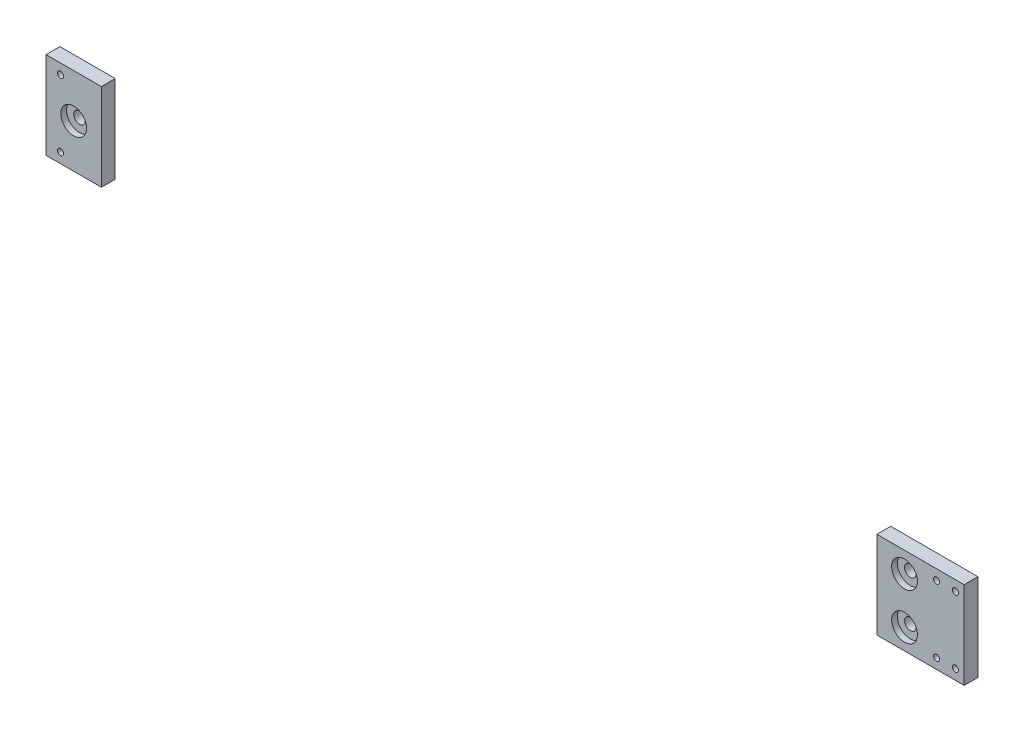
from build123d import *

# Parameters (mm, degrees)
SKETCH2_W                                 = 66.588019288
SKETCH2_H                                 = 60
MAIN_EXTRUSION_DEPTH                      = 5.55752
SKETCH2_W_2                               = 38.1
SKETCH2_R                                 = 3.96875
MAIN_EXTRUSION_2_DEPTH                    = 5.55752
SKETCH2_3_W                               = 66.588019288
SKETCH2_3_H                               = 60
SKETCH2_3_W_2                             = 38.1
SKETCH2_3_R                               = 8.89
COUNTERBORE_EXTRUSION_DEPTH               = 9.525
SKETCH3_R                                 = 2.1
M5_THREADED_HOLSE_FOR_FRONT_BRACKET_DEPTH = 9.525
SKETCH5_R                                 = 2.1
M5_THREADED_HOLES_FOR_BRACKET_DEPTH       = 9.525
CENTRE_BORE_DEPTH                         = 345.266911292
SKETCH6_3_R                               = 8.89
SKETCH6_3_R_2                             = 3.96875
COUNTERBORE_DEPTH                         = 3.96748
SKETCH7_W                                 = 6.55
SKETCH7_H                                 = 60
STUPID_CUT_DEPTH                          = 345.266911292


with BuildPart() as part:
    # Sketch2 → Main Extrusion (new body)
    with BuildSketch(Plane(origin=(-0.000152858, 6.01e-07, 0.001029772), x_dir=(1, 0, 0), z_dir=(0, 0, 1))):
        with Locations((309.531143156, -6.01e-07)):
            Rectangle(SKETCH2_W, SKETCH2_H)
    extrude(amount=MAIN_EXTRUSION_DEPTH)



with BuildPart() as body_2:
    # Sketch2 → Main Extrusion 2 (new body)
    with BuildSketch(Plane(origin=(-0.000152858, 6.01e-07, 0.001029772), x_dir=(1, 0, 0), z_dir=(0, 0, 1))):
        with Locations((-276.224847142, -6.01e-07)):
            Rectangle(SKETCH2_W_2, SKETCH2_H)
        with Locations(Location((-276.224847142, -6.01e-07, 0), (0, 0, 180))):
            Circle(SKETCH2_R, mode=Mode.SUBTRACT)
    extrude(amount=MAIN_EXTRUSION_2_DEPTH)


with BuildPart() as part_1:
    add(part.part)

    add(body_2.part)  # Counterbore extrusion merges body 2
    # Sketch2<3> → Counterbore extrusion (add)
    # profile 1 of 2: a face of its own
    with BuildSketch(Plane(origin=(-0.000152858, 6.01e-07, 0.001029772), x_dir=(1, 0, 0), z_dir=(0, 0, 1))):
        with Locations((309.531143156, -6.01e-07)):
            Rectangle(SKETCH2_3_W, SKETCH2_3_H)
    # profile 2 of 2: a face of its own
    with BuildSketch(Plane(origin=(-0.000152858, 6.01e-07, 0.001029772), x_dir=(1, 0, 0), z_dir=(0, 0, 1))):
        with Locations((-276.224847142, -6.01e-07)):
            Rectangle(SKETCH2_3_W_2, SKETCH2_3_H)
        with Locations(Location((-276.224847142, -6.01e-07, 0), (0, 0, 180))):
            Circle(SKETCH2_3_R, mode=Mode.SUBTRACT)
    extrude(amount=COUNTERBORE_EXTRUSION_DEPTH)

    # Sketch3 → M5 Threaded holse for front bracket (cut)
    with BuildSketch(Plane.XY.offset(9.526029772)):
        with Locations((-285.275, 23)):
            Circle(SKETCH3_R)
        with Locations((-285.275, -23)):
            Circle(SKETCH3_R)
    extrude(amount=-M5_THREADED_HOLSE_FOR_FRONT_BRACKET_DEPTH, mode=Mode.SUBTRACT)

    # Sketch5 → M5 Threaded holes for bracket (cut)
    with BuildSketch(Plane.XY.offset(9.526029772)):
        with Locations((317.274999942, 23)):
            Circle(SKETCH5_R)
        with Locations((330.274999942, 23)):
            Circle(SKETCH5_R)
        with Locations((330.274999942, -23)):
            Circle(SKETCH5_R)
        with Locations((317.274999942, -23)):
            Circle(SKETCH5_R)
    extrude(amount=-M5_THREADED_HOLES_FOR_BRACKET_DEPTH, mode=Mode.SUBTRACT)

    # Sketch6 → centre bore (cut, through all)
    with BuildSketch(Plane.XY.offset(9.526029772)):
        with BuildLine():
            ThreePointArc((295.275, 19.84375), (291.30625, 15.875), (295.275, 11.90625))
            Line((295.275, 11.90625), (295.275, 19.84375))
        make_face()
        with BuildLine():
            Line((295.275, 19.84375), (295.275, 11.90625))
            ThreePointArc((295.275, 11.90625), (298.081330038, 13.068669962), (299.24375, 15.875))
            ThreePointArc((299.24375, 15.875), (298.081330038, 18.681330038), (295.275, 19.84375))
        make_face()
        with BuildLine():
            ThreePointArc((295.275, -11.90625), (291.30625, -15.875), (295.275, -19.84375))
            Line((295.275, -19.84375), (295.275, -11.90625))
        make_face()
        with BuildLine():
            Line((295.275, -11.90625), (295.275, -19.84375))
            ThreePointArc((295.275, -19.84375), (298.081330038, -18.681330038), (299.24375, -15.875))
            ThreePointArc((299.24375, -15.875), (298.081330038, -13.068669962), (295.275, -11.90625))
        make_face()
    extrude(amount=-CENTRE_BORE_DEPTH, mode=Mode.SUBTRACT)

    # Sketch6<3> → counterbore (cut)
    # profile 1 of 2: a face of its own
    with BuildSketch(Plane.XY.offset(9.526029772)):
        with Locations((295.275, 15.875)):
            Circle(SKETCH6_3_R)
        with Locations((295.275, 15.875)):
            Circle(SKETCH6_3_R_2, mode=Mode.SUBTRACT)
    # profile 2 of 2: a face of its own
    with BuildSketch(Plane.XY.offset(9.526029772)):
        with Locations((295.275, -15.875)):
            Circle(SKETCH6_3_R)
        with Locations((295.275, -15.875)):
            Circle(SKETCH6_3_R_2, mode=Mode.SUBTRACT)
    extrude(amount=-COUNTERBORE_DEPTH, mode=Mode.SUBTRACT)

    # Sketch7 → stupid cut (cut, through all)
    with BuildSketch(Plane.XY.offset(9.526029772)):
        with Locations((339.549999942, 0)):
            Rectangle(SKETCH7_W, SKETCH7_H)
    extrude(amount=-STUPID_CUT_DEPTH, mode=Mode.SUBTRACT)


solid = part_1.part
